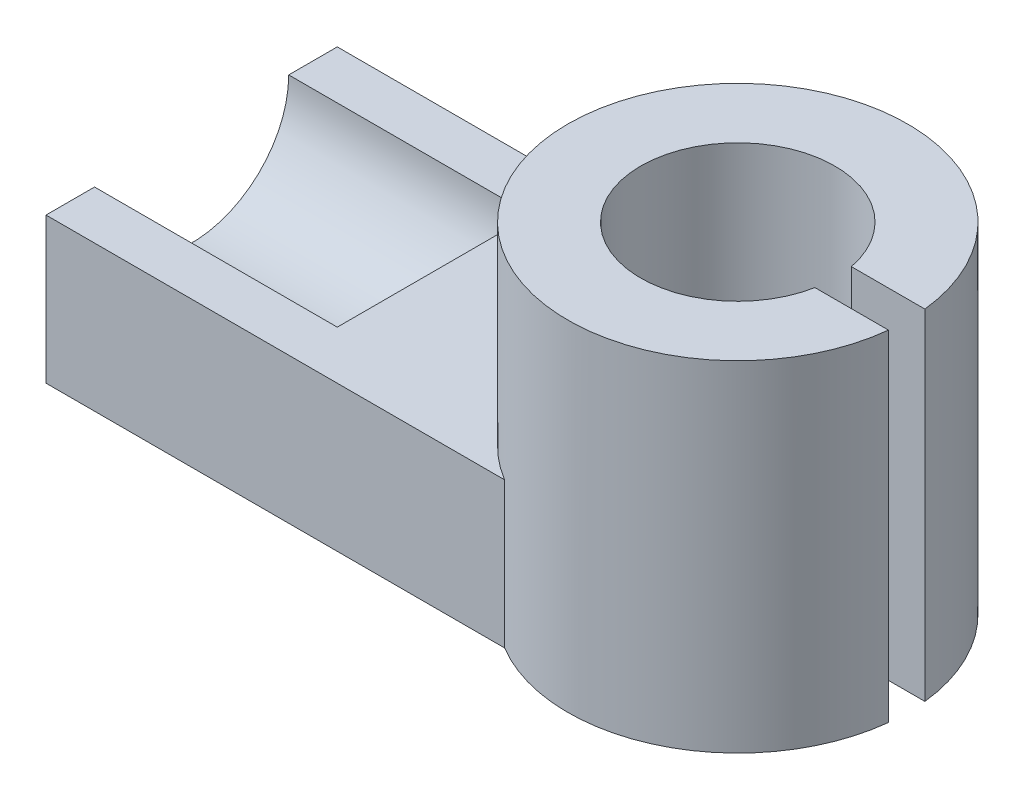
from build123d import *

# Parameters (mm, degrees)
BOSS_EXTRUDE1_DEPTH = 56
BOSS_EXTRUDE2_DEPTH = 24
SKETCH5_R           = 16
CUT_EXTRUDE1_DEPTH  = 40


with BuildPart() as part:
    # Sketch1 → Boss-Extrude1 (new body)
    with BuildSketch(Plane(origin=(0, 0, 0), x_dir=(1, 0, 0), z_dir=(0, 1, 0))):
        with BuildLine():
            Line((27.838821814, -3), (15.716233646, -3))
            ThreePointArc((15.716233646, -3), (-16, 0), (15.716233646, 3))
            Line((15.716233646, 3), (27.838821814, 3))
            ThreePointArc((27.838821814, 3), (-28, 0), (27.838821814, -3))
        make_face()
    extrude(amount=BOSS_EXTRUDE1_DEPTH)

    # Sketch3 → Boss-Extrude2 (add)
    with BuildSketch(Plane.XZ):
        with BuildLine():
            Line((-90, -24), (-14.422205102, -24))
            ThreePointArc((-14.422205102, -24), (-28, 0), (-14.422205102, 24))
            Line((-14.422205102, 24), (-90, 24))
            Line((-90, 24), (-90, -24))
        make_face()
    extrude(amount=-BOSS_EXTRUDE2_DEPTH)

    # Sketch5 → Cut-Extrude1 (cut)
    with BuildSketch(Plane.ZY.offset(90)):
        with Locations((0, 24)):
            Circle(SKETCH5_R)
    extrude(amount=-CUT_EXTRUDE1_DEPTH, mode=Mode.SUBTRACT)


solid = part.part
